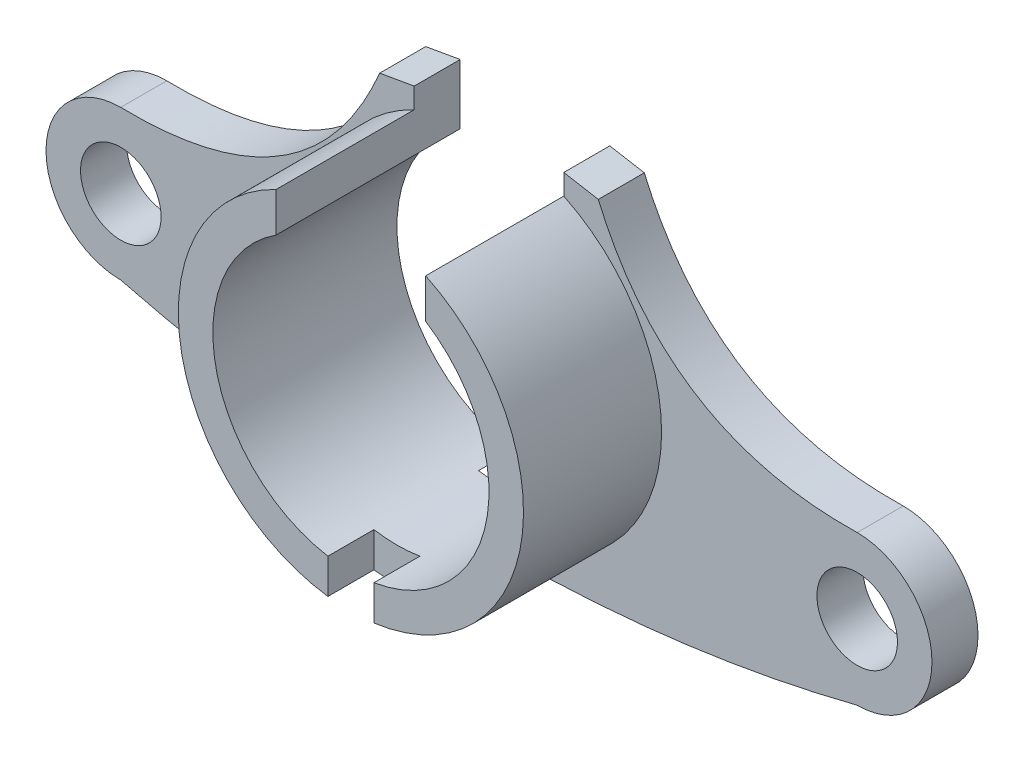
from build123d import *

# Parameters (mm, degrees)
SKETCH1_R           = 1.75
BOSS_EXTRUDE1_DEPTH = 2
BOSS_EXTRUDE2_DEPTH = 6
SKETCH4_W           = 2
SKETCH4_H           = 1.583920217
CUT_EXTRUDE1_DEPTH  = 2
SKETCH5_R           = 2.75
CUT_EXTRUDE3_DEPTH  = 1.5


with BuildPart() as part:
    # Sketch1 → Boss-Extrude1 (new body)
    # profile 1 of 3: a face of its own
    with BuildSketch(Plane.XY):
        with BuildLine():
            ThreePointArc((-12.75, 81), (-13.657806533, 83.25313776), (-15.874079855, 84.247559717))
            add(Edge.make_bspline(
                [(-16, 84.25), (-15.936886934, 84.248565124), (-15.874079855, 84.247559717)],
                knots=[0, 0, 0, 0.007677399, 0.007677399, 0.007677399], degree=2))
            ThreePointArc((-16, 84.25), (-19.25, 81), (-16, 77.75))
            ThreePointArc((-16, 77.75), (-13.701902961, 78.701902961), (-12.75, 81))
        make_face()
        with Locations((-16, 81)):
            Circle(SKETCH1_R, mode=Mode.SUBTRACT)
    # profile 2 of 3: a face of its own
    with BuildSketch(Plane.XY):
        with BuildLine():
            ThreePointArc((6, 83.776937313), (-2.872281323, 78.509110436), (-3.25, 88.820497563))
            Line((-3.25, 88.820497563), (-3.25, 91.426937313))
            Line((-3.25, 91.426937313), (-4.75, 91.162446842))
            add(Edge.make_bspline(
                [(-15.874079855, 84.247559717), (-7.75611093, 84.117608401), (-4.75, 91.162446842)],
                knots=[0.007677399, 0.007677399, 0.007677399, 1, 1, 1], degree=2))
            ThreePointArc((-15.874079855, 84.247559717), (-13.657806533, 83.25313776), (-12.75, 81))
            ThreePointArc((-12.75, 81), (-13.701902961, 78.701902961), (-16, 77.75))
            add(Edge.make_bspline(
                [(-16, 77.75), (-8.124796889, 75.747320021), (0, 75.776937313)],
                knots=[0, 0, 0, 1, 1, 1], degree=2))
            add(Edge.make_bspline(
                [(16, 77.75), (8.124796889, 75.747320021), (0, 75.776937313)],
                knots=[0, 0, 0, 1, 1, 1], degree=2))
            ThreePointArc((16, 77.75), (12.750610128, 80.937028105), (15.874079855, 84.247559717))
            add(Edge.make_bspline(
                [(15.874079855, 84.247559717), (7.75611093, 84.117608401), (4.75, 91.162446842)],
                knots=[0.007677399, 0.007677399, 0.007677399, 1, 1, 1], degree=2))
            Line((4.75, 91.162446842), (3.25, 91.426937313))
            Line((3.25, 91.426937313), (3.25, 88.820497563))
            ThreePointArc((3.25, 88.820497563), (5.267826876, 86.649218636), (6, 83.776937313))
        make_face()
    # profile 3 of 3: a face of its own
    with BuildSketch(Plane.XY):
        with BuildLine():
            add(Edge.make_bspline(
                [(16, 84.25), (15.936886934, 84.248565124), (15.874079855, 84.247559717)],
                knots=[0, 0, 0, 0.007677399, 0.007677399, 0.007677399], degree=2))
            ThreePointArc((15.874079855, 84.247559717), (12.750610128, 80.937028105), (16, 77.75))
            ThreePointArc((16, 77.75), (18.298097039, 78.701902961), (19.25, 81))
            ThreePointArc((19.25, 81), (18.298097039, 83.298097039), (16, 84.25))
        make_face()
        with Locations((16, 81)):
            Circle(SKETCH1_R, mode=Mode.SUBTRACT)
    extrude(amount=BOSS_EXTRUDE1_DEPTH)

    # Sketch2 → Boss-Extrude2 (add)
    with BuildSketch(Plane.XY.offset(2)):
        with BuildLine():
            ThreePointArc((7.5, 83.776937313), (6.34921255, 87.769117168), (3.25, 90.53619023))
            Line((3.25, 90.53619023), (3.25, 88.820497563))
            ThreePointArc((3.25, 88.820497563), (5.267826876, 86.649218636), (6, 83.776937313))
            ThreePointArc((6, 83.776937313), (-2.872281323, 78.509110436), (-3.25, 88.820497563))
            Line((-3.25, 88.820497563), (-3.25, 90.53619023))
            ThreePointArc((-3.25, 90.53619023), (-3.992179856, 77.427724763), (7.5, 83.776937313))
        make_face()
    extrude(amount=BOSS_EXTRUDE2_DEPTH)

    # Sketch4 → Cut-Extrude1 (cut)
    with BuildSketch(Plane.XY.offset(8)):
        with Locations((0, 77.068897421)):
            Rectangle(SKETCH4_W, SKETCH4_H)
    extrude(amount=-CUT_EXTRUDE1_DEPTH, mode=Mode.SUBTRACT)

    # Sketch5 → Cut-Extrude3 (cut)
    with BuildSketch(Plane(origin=(0, 0, 0), x_dir=(-1, 0, 0), z_dir=(0, 0, -1))):
        with Locations((0, 75.274341128)):
            Circle(SKETCH5_R)
    extrude(amount=-CUT_EXTRUDE3_DEPTH, mode=Mode.SUBTRACT)


solid = part.part
